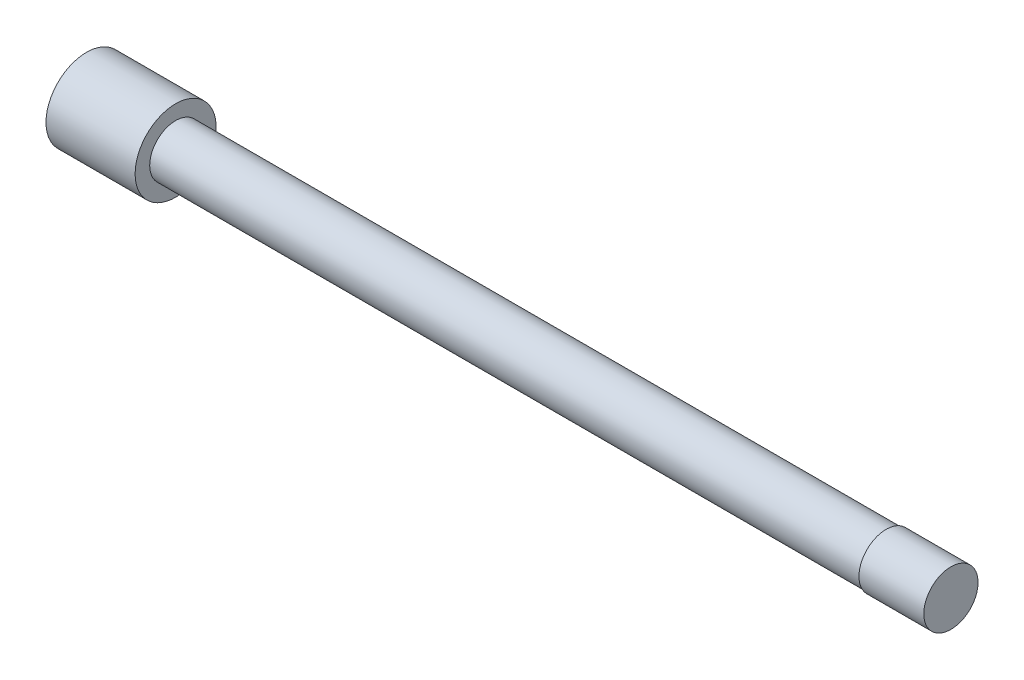
from build123d import *


with BuildPart() as part:
    # Axial profile (mm) → Full revolution (revolve)
    with BuildSketch(Plane.XY, mode=Mode.PRIVATE) as full_revolution_sk:
        Polygon((50, 3.25), (58, 3.25), (58, 0), (156.7, 0), (156.7, 3.35), (148.7, 3.35), (148.7, 3.2), (61, 3.2), (61, 5), (50, 5), align=None)
    revolve(full_revolution_sk.sketch.rotate(Axis((-110, 0, 0), (1, 0, 0)), 90), axis=Axis((-110, 0, 0), (1, 0, 0)))


solid = part.part
